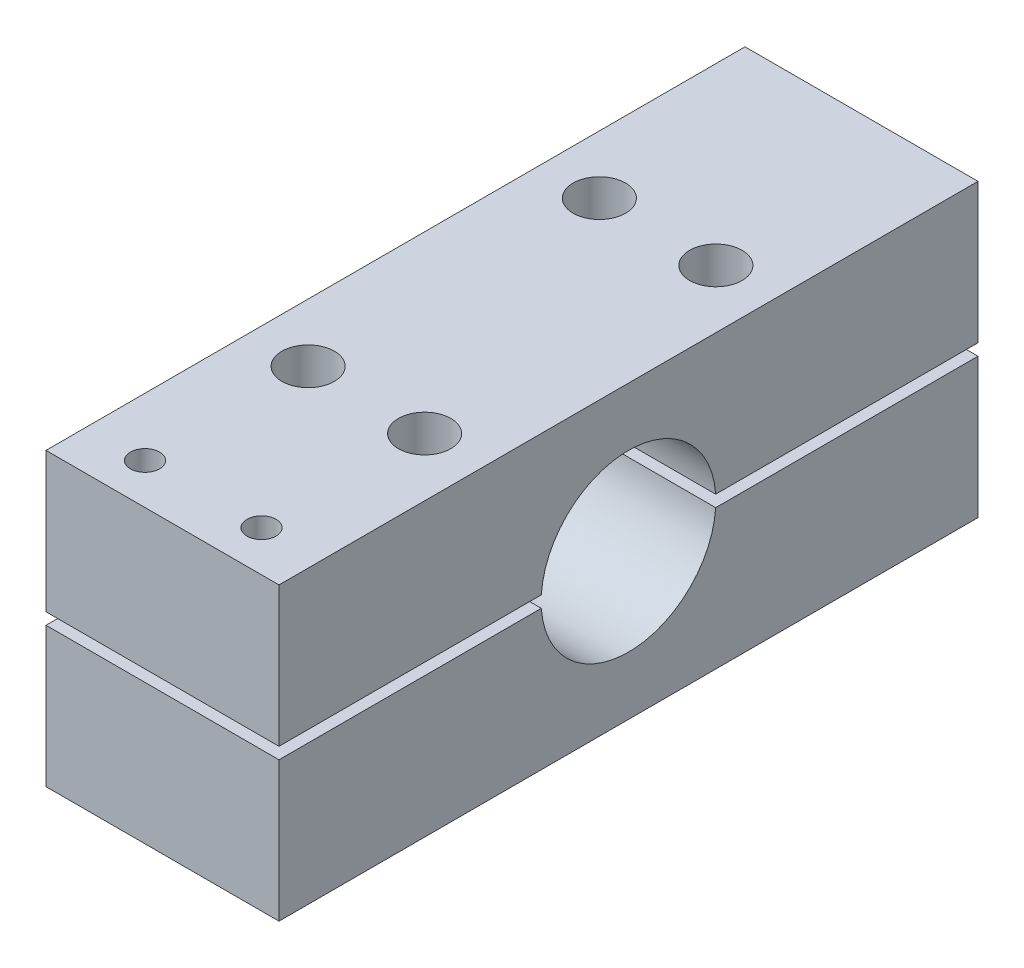
from build123d import *

# Parameters (mm, degrees)
SKIZZE1_W                                    = 120
SKIZZE1_H                                    = 50
SKIZZE1_R                                    = 15
AUFSATZ_LINEAR_AUSTRAGEN1_DEPTH              = 20
SKIZZE2_W                                    = 120
SKIZZE2_H                                    = 2
SCHNITT_LINEAR_AUSTRAGEN1_DEPTH              = 77.321687612
SKIZZE3_W                                    = 3.4
SKIZZE3_H                                    = 24
M8_GEWINDEBOHRUNG1_AT_2_COUNT                = 2
M8_GEWINDEBOHRUNG1_AT_2_PITCH                = 50
M8_GEWINDEBOHRUNG1_AT_3_COUNT                = 2
M8_GEWINDEBOHRUNG1_AT_3_PITCH                = 53.851648071
M8_GEWINDEBOHRUNG1_AT_4_COUNT                = 2
M8_GEWINDEBOHRUNG1_AT_4_PITCH                = 20
F_9_0_9_DURCHMESSER_BOHRUNG1_AT_2_COUNT      = 2
F_9_0_9_DURCHMESSER_BOHRUNG1_AT_2_PITCH      = 50
F_9_0_9_DURCHMESSER_BOHRUNG1_AT_3_COUNT      = 2
F_9_0_9_DURCHMESSER_BOHRUNG1_AT_3_PITCH      = 53.851648071
F_9_0_9_DURCHMESSER_BOHRUNG1_AT_4_COUNT      = 2
F_9_0_9_DURCHMESSER_BOHRUNG1_AT_4_PITCH      = 20
STIRNSENKUNG_F_R_M10_ZYLINDERSCHRAUB_2_COUNT = 2
STIRNSENKUNG_F_R_M10_ZYLINDERSCHRAUB_2_PITCH = 90
M6_GEWINDEBOHRUNG1_AT_2_COUNT                = 2
M6_GEWINDEBOHRUNG1_AT_2_PITCH                = 20


with BuildPart() as part:
    # Skizze1 → Aufsatz-Linear austragen1 (new, symmetric)
    with BuildSketch(Plane(origin=(0, 0, 0), x_dir=(0, 0, -1), z_dir=(1, 0, 0))):
        Rectangle(SKIZZE1_W, SKIZZE1_H)
        Circle(SKIZZE1_R, mode=Mode.SUBTRACT)
    extrude(amount=AUFSATZ_LINEAR_AUSTRAGEN1_DEPTH, both=True)

    # Skizze2 → Schnitt-Linear austragen1 (cut, through all)
    with BuildSketch(Plane(origin=(20, 0, 0), x_dir=(0, 0, -1), z_dir=(1, 0, 0))):
        Rectangle(SKIZZE2_W, SKIZZE2_H)
    extrude(amount=-SCHNITT_LINEAR_AUSTRAGEN1_DEPTH, mode=Mode.SUBTRACT)


with BuildPart() as schnitt_linear_austragen1_piece_1:
    # of the separate pieces the step leaves, piece 1, a body of its own (schnitt_linear_austragen1_pieces)
    add(part.part.solids().sort_by_distance((-20, 25, 60))[0])

    # Skizze5 → Ø9.0 (9) Durchmesser Bohrung1 (revolve, cut)
    with BuildSketch(Plane(origin=(-10, 25, 25), x_dir=(0, 0, 1), z_dir=(1, 0, 0))):
        Polygon((0, 0), (0, 27.703872786), (4.5, 25), (4.5, 0), align=None)
    f_9_0_9_durchmesser_bohrung1 = revolve(axis=Axis((-10, 31.35, 25), (0, -1, 0)), mode=Mode.SUBTRACT)

    # Ø9.0 (9) Durchmesser Bohrung1 at 2: Ø9.0 (9) Durchmesser Bohrung1 ×2
    with Locations(*[(0, 0, -i * F_9_0_9_DURCHMESSER_BOHRUNG1_AT_2_PITCH) for i in range(1, F_9_0_9_DURCHMESSER_BOHRUNG1_AT_2_COUNT)]):
        add(f_9_0_9_durchmesser_bohrung1, mode=Mode.SUBTRACT)

    # Ø9.0 (9) Durchmesser Bohrung1 at 3: Ø9.0 (9) Durchmesser Bohrung1 ×2
    with Locations(*[Vector(0.3713906763541037, 0, -0.9284766908852593) * (i * F_9_0_9_DURCHMESSER_BOHRUNG1_AT_3_PITCH) for i in range(1, F_9_0_9_DURCHMESSER_BOHRUNG1_AT_3_COUNT)]):
        add(f_9_0_9_durchmesser_bohrung1, mode=Mode.SUBTRACT)

    # Ø9.0 (9) Durchmesser Bohrung1 at 4: Ø9.0 (9) Durchmesser Bohrung1 ×2
    with Locations(*[(i * F_9_0_9_DURCHMESSER_BOHRUNG1_AT_4_PITCH, 0, 0) for i in range(1, F_9_0_9_DURCHMESSER_BOHRUNG1_AT_4_COUNT)]):
        add(f_9_0_9_durchmesser_bohrung1, mode=Mode.SUBTRACT)

    # Skizze9 → M6 Gewindebohrung1 (revolve, cut)
    with BuildSketch(Plane(origin=(-10, 25, 53), x_dir=(0, 0, 1), z_dir=(1, 0, 0))):
        Polygon((0, 0), (0, 18.502151548), (2.5, 17), (2.5, 0), align=None)
    m6_gewindebohrung1 = revolve(axis=Axis((-10, 31.35, 53), (0, -1, 0)), mode=Mode.SUBTRACT)

    # M6 Gewindebohrung1 at 2: M6 Gewindebohrung1 ×2
    with Locations(*[(i * M6_GEWINDEBOHRUNG1_AT_2_PITCH, 0, 0) for i in range(1, M6_GEWINDEBOHRUNG1_AT_2_COUNT)]):
        add(m6_gewindebohrung1, mode=Mode.SUBTRACT)


with BuildPart() as schnitt_linear_austragen1_piece_2:
    # of the separate pieces the step leaves, piece 2, a body of its own (schnitt_linear_austragen1_pieces)
    add(part.part.solids().sort_by_distance((-20, -25, 60))[0])

    # Skizze3 → M8 Gewindebohrung1 (revolve, cut)
    with BuildSketch(Plane(origin=(10, -1, 25), x_dir=(0, 0, 1), z_dir=(1, 0, 0))):
        with Locations((1.7, 12)):
            Rectangle(SKIZZE3_W, SKIZZE3_H)
    m8_gewindebohrung1 = revolve(axis=Axis((10, 5.35, 25), (0, -1, 0)), mode=Mode.SUBTRACT)

    # M8 Gewindebohrung1 at 2: M8 Gewindebohrung1 ×2
    with Locations(*[(0, 0, -i * M8_GEWINDEBOHRUNG1_AT_2_PITCH) for i in range(1, M8_GEWINDEBOHRUNG1_AT_2_COUNT)]):
        add(m8_gewindebohrung1, mode=Mode.SUBTRACT)

    # M8 Gewindebohrung1 at 3: M8 Gewindebohrung1 ×2
    with Locations(*[Vector(-0.3713906763541038, 0, -0.9284766908852593) * (i * M8_GEWINDEBOHRUNG1_AT_3_PITCH) for i in range(1, M8_GEWINDEBOHRUNG1_AT_3_COUNT)]):
        add(m8_gewindebohrung1, mode=Mode.SUBTRACT)

    # M8 Gewindebohrung1 at 4: M8 Gewindebohrung1 ×2
    with Locations(*[(-i * M8_GEWINDEBOHRUNG1_AT_4_PITCH, 0, 0) for i in range(1, M8_GEWINDEBOHRUNG1_AT_4_COUNT)]):
        add(m8_gewindebohrung1, mode=Mode.SUBTRACT)

    # Skizze7 → Stirnsenkung für M10 Zylinderschraube mit Innensechskant2 (revolve, cut)
    with BuildSketch(Plane(origin=(0, -1, 45), x_dir=(0, 0, 1), z_dir=(1, 0, 0))):
        Polygon((0, 0), (0, 24), (5.5, 24), (5.5, 10.6), (9, 10.6), (9, 0), align=None)
    stirnsenkung_f_r_m10_zylinderschraube_mi = revolve(axis=Axis((0, 5.35, 45), (0, -1, 0)), mode=Mode.SUBTRACT)

    # Stirnsenkung f_r M10 Zylinderschraub 2: Stirnsenkung für M10 Zylinderschraube mit Innensechskant2 ×2
    with Locations(*[(0, 0, -i * STIRNSENKUNG_F_R_M10_ZYLINDERSCHRAUB_2_PITCH) for i in range(1, STIRNSENKUNG_F_R_M10_ZYLINDERSCHRAUB_2_COUNT)]):
        add(stirnsenkung_f_r_m10_zylinderschraube_mi, mode=Mode.SUBTRACT)


solid = Compound([schnitt_linear_austragen1_piece_1.part, schnitt_linear_austragen1_piece_2.part])
